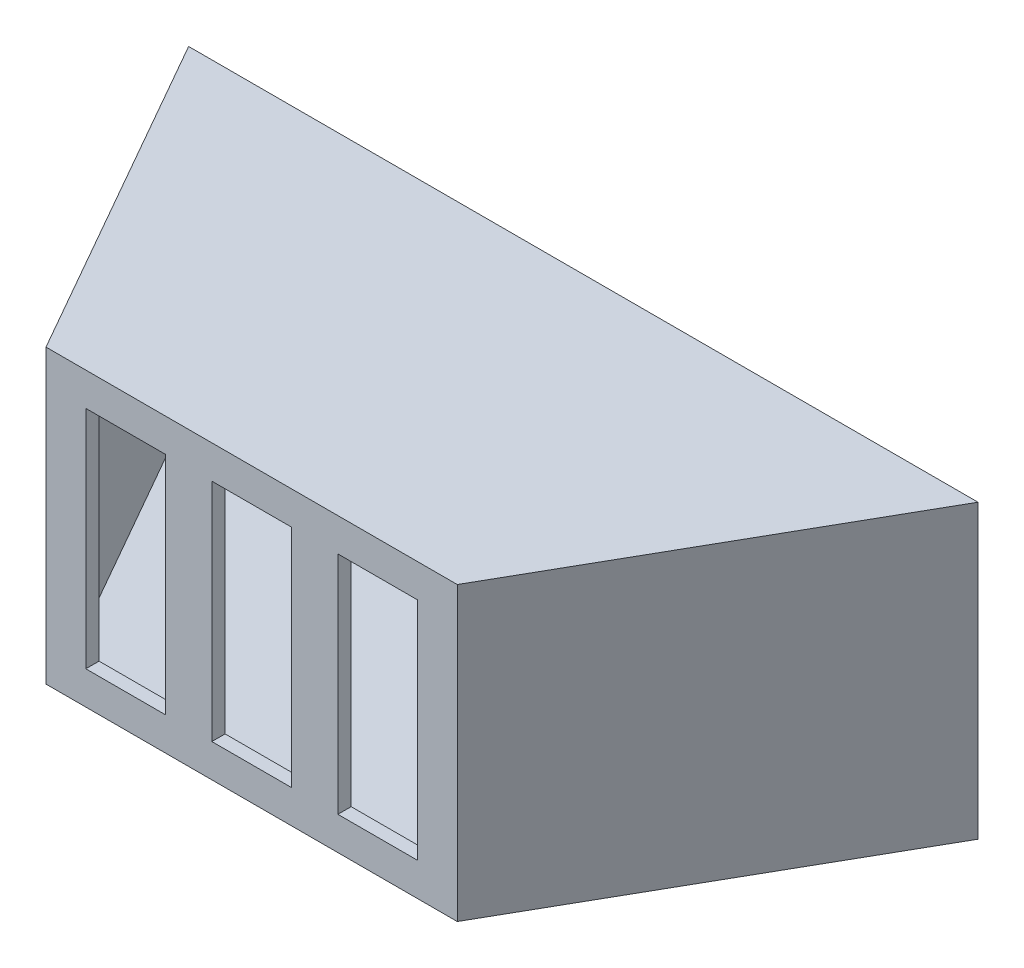
from build123d import *

# Parameters (mm, degrees)
EXTRUS_O1_DEPTH = 44
CASCA1_T        = -2
EXTRUS_O2_DEPTH = 40
ESBO_O6_R       = 5.25
EXTRUS_O3_DEPTH = 2
ESBO_O5_R       = 5.25
EXTRUS_O4_DEPTH = 2
ESBO_O7_W       = 12
ESBO_O7_H       = 34
EXTRUS_O5_DEPTH = 2


with BuildPart() as part:
    # Esboço1 → Extrusão1 (new body)
    with BuildSketch(Plane(origin=(0, 0, 0), x_dir=(1, 0, 0), z_dir=(0, 1, 0))):
        Polygon((-59.5, 45.323641576), (-31, -4.676358424), (31, -4.676358424), (59.5, 45.323641576), align=None)
    extrude(amount=EXTRUS_O1_DEPTH)

    # Casca1
    casca1_openings = [part.faces().sort_by_distance(p)[0] for p in [
        (0, 22, -45.323641576),
    ]]
    offset(amount=CASCA1_T, openings=casca1_openings, kind=Kind.INTERSECTION)

    # Esboço4 → Extrusão2 (add)
    with BuildSketch(Plane.XZ.offset(-42)):
        Polygon((-57.197913989, -45.323641576), (-42.197913989, -45.323641576), (-42.197913989, -42.323641576), (-55.487913989, -42.323641576), align=None)
    extrus_o2 = extrude(amount=EXTRUS_O2_DEPTH)

    # Espelhar1: Extrusão2 across plane
    add(extrus_o2.mirror(Plane(origin=(0, 0, 0), x_dir=(0, 0, 1), z_dir=(1, 0, 0))))

    # Esboço6 → Extrusão3 (cut)
    with BuildSketch(Plane.XY.offset(-42.323641576)):
        with Locations((-49.5, 10)):
            Circle(ESBO_O6_R)
    extrus_o3 = extrude(amount=-EXTRUS_O3_DEPTH, mode=Mode.SUBTRACT)

    # Esboço5 → Extrusão4 (cut)
    with BuildSketch(Plane.XY.offset(-42.323641576)):
        with Locations((-49.5, 34)):
            Circle(ESBO_O5_R)
    extrus_o4 = extrude(amount=-EXTRUS_O4_DEPTH, mode=Mode.SUBTRACT)

    # Espelhar2: Extrusão3, Extrusão4 across plane
    add(extrus_o3.mirror(Plane(origin=(0, 0, 0), x_dir=(0, 0, 1), z_dir=(1, 0, 0))), mode=Mode.SUBTRACT)
    add(extrus_o4.mirror(Plane(origin=(0, 0, 0), x_dir=(0, 0, 1), z_dir=(1, 0, 0))), mode=Mode.SUBTRACT)

    # Esboço7 → Extrusão5 (cut)
    with BuildSketch(Plane.XY.offset(4.676358424)):
        with Locations((0, 22)):
            Rectangle(ESBO_O7_W, ESBO_O7_H)
        with Locations((19, 22)):
            Rectangle(ESBO_O7_W, ESBO_O7_H)
        with Locations((-19, 22)):
            Rectangle(ESBO_O7_W, ESBO_O7_H)
    extrude(amount=-EXTRUS_O5_DEPTH, mode=Mode.SUBTRACT)


solid = part.part
